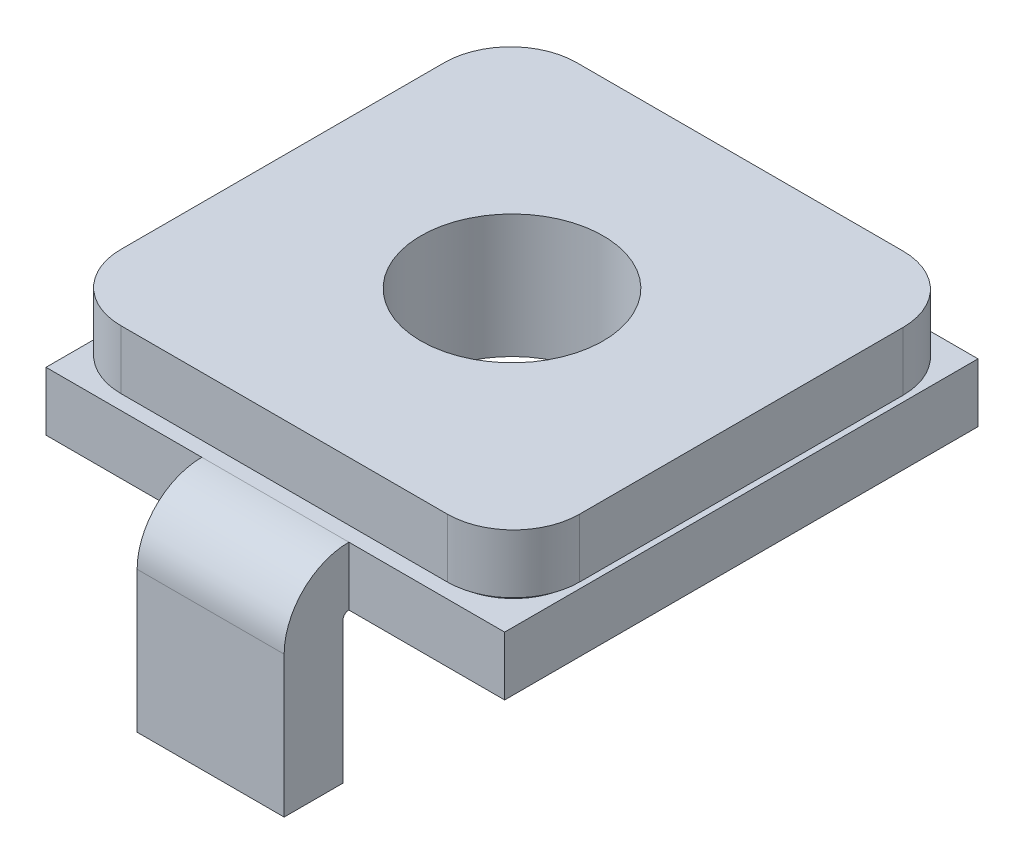
from build123d import *

# Parameters (mm, degrees)
BOSS_EXTRUDE1_DEPTH = 3.9
SKETCH2_W           = 0.125
SKETCH2_H           = 0.1
CUT_EXTRUDE1_DEPTH  = 11.306581635
FILLET1_R           = 1
FILLET2_R           = 1.125
SKETCH3_W           = 2.65
SKETCH3_H           = 1.1
CUT_EXTRUDE2_DEPTH  = 8.91426718
SKETCH4_R           = 1.55
CUT_EXTRUDE3_DEPTH  = 8.91426718


with BuildPart() as part:
    # Sketch1 → Boss-Extrude1 (new, symmetric)
    with BuildSketch(Plane(origin=(0, 0, 0), x_dir=(0, 0, -1), z_dir=(1, 0, 0))):
        with BuildLine():
            Line((-5.125, -3.5), (-5.125, -1.1))
            ThreePointArc((-5.125, -1.1), (-4.802817459, -0.322182541), (-4.025, 0))
            Line((-4.025, 0), (-3.75, 0))
            Line((-3.75, 0), (-3.75, 0.1))
            Line((-3.75, 0.1), (-3.875, 0.1))
            Line((-3.875, 0.1), (-3.875, 1.1))
            Line((-3.875, 1.1), (3.875, 1.1))
            Line((3.875, 1.1), (3.875, 0.1))
            Line((3.875, 0.1), (3.75, 0.1))
            Line((3.75, 0.1), (3.75, 0))
            Line((3.75, 0), (4.025, 0))
            ThreePointArc((4.025, 0), (4.802817459, -0.322182541), (5.125, -1.1))
            Line((5.125, -1.1), (5.125, -3.5))
            Line((5.125, -3.5), (4.125, -3.5))
            Line((4.125, -3.5), (4.125, -1.1))
            ThreePointArc((4.125, -1.1), (4.095710678, -1.029289322), (4.025, -1))
            Line((4.025, -1), (-4.025, -1))
            ThreePointArc((-4.025, -1), (-4.095710678, -1.029289322), (-4.125, -1.1))
            Line((-4.125, -1.1), (-4.125, -3.5))
            Line((-4.125, -3.5), (-5.125, -3.5))
        make_face()
    extrude(amount=BOSS_EXTRUDE1_DEPTH, both=True)

    # Sketch2 → Cut-Extrude1 (cut, through all)
    with BuildSketch(Plane.XY.offset(3.75)):
        with Locations((3.8375, 0.05)):
            Rectangle(SKETCH2_W, SKETCH2_H)
        with Locations((-3.8375, 0.05)):
            Rectangle(SKETCH2_W, SKETCH2_H)
    extrude(amount=-CUT_EXTRUDE1_DEPTH, mode=Mode.SUBTRACT)

    # Fillet1
    fillet1_edges = [part.edges().sort_by_distance(p)[0] for p in [
        (3.775, 0.05, -3.75),
        (3.775, 0.05, 3.75),
        (-3.775, 0.05, -3.75),
        (-3.775, 0.05, 3.75),
    ]]
    fillet(fillet1_edges, radius=FILLET1_R)

    # Fillet2
    fillet2_edges = [part.edges().sort_by_distance(p)[0] for p in [
        (-3.9, 0.6, 3.875),
        (-3.9, 0.6, -3.875),
        (3.9, 0.6, -3.875),
        (3.9, 0.6, 3.875),
    ]]
    fillet(fillet2_edges, radius=FILLET2_R)

    # Sketch3 → Cut-Extrude2 (cut, through all)
    with BuildSketch(Plane.XZ.offset(3.5)):
        with Locations((2.575, 4.575)):
            Rectangle(SKETCH3_W, SKETCH3_H)
        with Locations((-2.575, 4.575)):
            Rectangle(SKETCH3_W, SKETCH3_H)
    cut_extrude2 = extrude(amount=-CUT_EXTRUDE2_DEPTH, mode=Mode.SUBTRACT)

    # Mirror1: Cut-Extrude2 across plane
    add(cut_extrude2.mirror(Plane.XY), mode=Mode.SUBTRACT)

    # Sketch4 → Cut-Extrude3 (cut, through all)
    with BuildSketch(Plane(origin=(0, 1.1, 0), x_dir=(1, 0, 0), z_dir=(0, 1, 0))):
        with Locations(Location((0, 0, 0), (0, 0, 270))):
            Circle(SKETCH4_R)
    extrude(amount=-CUT_EXTRUDE3_DEPTH, mode=Mode.SUBTRACT)


solid = part.part
